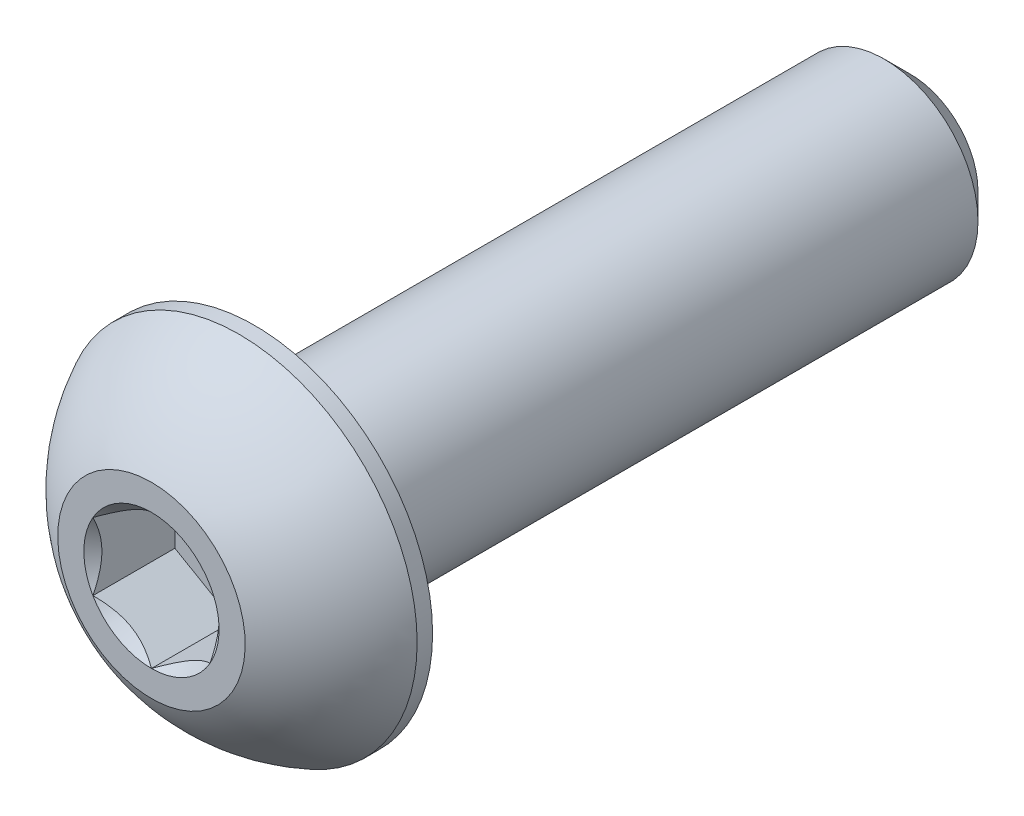
from build123d import *

# Parameters (mm, degrees)
CUT_EXTRUDE1_DEPTH = 1.75


with BuildPart() as part:
    # Sketch2 → Revolve1 (revolve)
    with BuildSketch(Plane(origin=(0, 0, 0), x_dir=(0, 0, -1), z_dir=(1, 0, 0)), mode=Mode.PRIVATE) as revolve1_sk:
        with BuildLine():
            Line((-8.1, 0), (8.1, 0))
            Line((8.1, 0), (8.1, 1.44))
            Line((8.1, 1.44), (7.54, 2))
            Line((7.54, 2), (-5.9, 2))
            Line((-5.9, 2), (-5.9, 3.8))
            Line((-5.9, 3.8), (-6.23, 3.8))
            ThreePointArc((-6.23, 3.8), (-7.306499853, 3.047002626), (-8.1, 2))
            Line((-8.1, 2), (-8.1, 0))
        make_face()
    revolve(revolve1_sk.sketch.rotate(Axis((0, 0, 8.1), (0, 0, -1)), 90), axis=Axis((0, 0, 8.1), (0, 0, -1)))

    # Sketch3 → Cut-Extrude1 (cut)
    with BuildSketch(Plane.XY.offset(8.1)):
        Polygon((0, 1.443375673), (-1.25, 0.721687836), (-1.25, -0.721687836), (0, -1.443375673), (1.25, -0.721687836), (1.25, 0.721687836), align=None)
    extrude(amount=-CUT_EXTRUDE1_DEPTH, mode=Mode.SUBTRACT)

    # Cut-Extrude2 cone 1 section (through the dimple's axis) → Cut-Extrude2 (revolve, cut)
    with BuildSketch(Plane(origin=(0, 0, 8.1), x_dir=(0, -1, 0), z_dir=(1, 0, 0))):
        Polygon((0, 0), (1.443375673, 0), (0, 1.443375673), align=None)
    revolve(axis=Axis((0, 0, 8.1), (0, 0, -1)), mode=Mode.SUBTRACT)


solid = part.part
